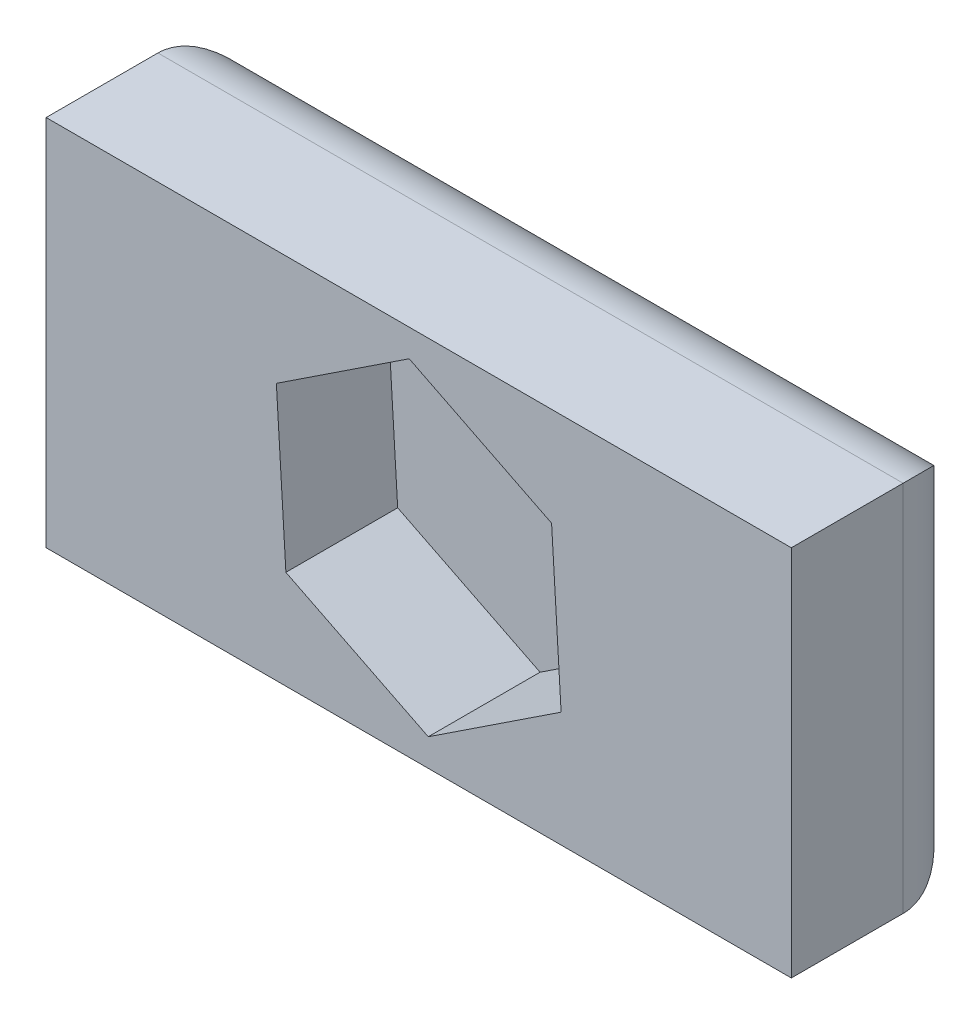
from build123d import *

# Parameters (mm, degrees)
SKETCH1_W           = 20
SKETCH1_H           = 10
BOSS_EXTRUDE1_DEPTH = 5
CUT_EXTRUDE1_DEPTH  = 3
FILLET1_R           = 2


with BuildPart() as part:
    # Sketch1 → Boss-Extrude1 (new body)
    with BuildSketch(Plane.XY):
        Rectangle(SKETCH1_W, SKETCH1_H)
    extrude(amount=BOSS_EXTRUDE1_DEPTH)

    # Sketch2 → Cut-Extrude1 (cut)
    with BuildSketch(Plane.XY.offset(5)):
        Polygon((0.255981481, -4.264716499), (3.821343568, -1.910671784), (3.565362087, 2.354044715), (-0.255981481, 4.264716499), (-3.821343568, 1.910671784), (-3.565362087, -2.354044715), align=None)
    extrude(amount=-CUT_EXTRUDE1_DEPTH, mode=Mode.SUBTRACT)

    # Fillet1
    fillet1_edges = [part.edges().sort_by_distance(p)[0] for p in [
        (0, -5, 0),
        (-10, 0, 0),
        (0, 5, 0),
        (10, 0, 0),
    ]]
    fillet(fillet1_edges, radius=FILLET1_R)


solid = part.part
